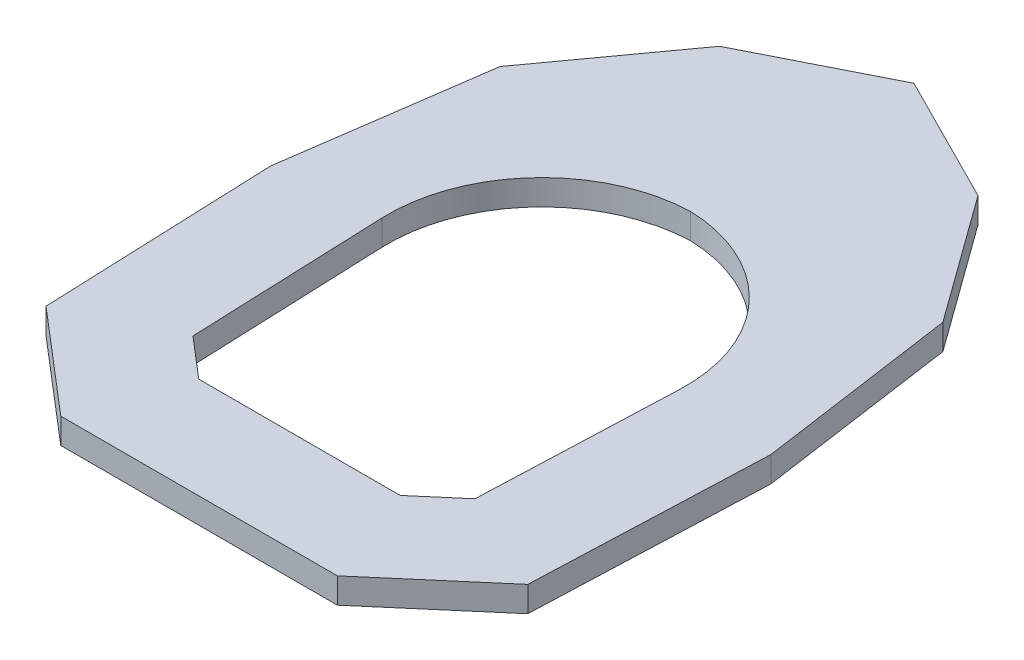
from build123d import *

# Parameters (mm, degrees)
BOSS_EXTRUDE1_DEPTH = 50


with BuildPart() as part:
    # Sketch1 → Boss-Extrude1 (new body)
    with BuildSketch(Plane(origin=(0, 0, 0), x_dir=(1, 0, 0), z_dir=(0, 1, 0))):
        Polygon((-490.415824699, -64.194072769), (-472.477870031, -524.138824529), (-270.660991621, -696.876695154), (273.24324441, -696.876695154), (475.06012282, -524.138824529), (492.998077488, -64.194072769), (436.803486749, 330.511591748), (255.52688097, 580.827312496), (1.291126394, 709.058947943), (-252.944628181, 580.827312496), (-434.22123396, 330.511591748), align=None)
        with BuildLine():
            Line((198.047881985, -498.167821548), (-198.047881985, -498.167821548))
            Line((-198.047881985, -498.167821548), (-277.326571574, -430.312089493))
            Line((-277.326571574, -430.312089493), (-292.42397797, -43.20146483))
            ThreePointArc((-292.42397797, -43.20146483), (-211.574023689, 174.749059805), (0, 271.058866137))
            ThreePointArc((0, 271.058866137), (211.574023689, 174.749059805), (292.42397797, -43.20146483))
            Line((292.42397797, -43.20146483), (277.326571574, -430.312089493))
            Line((277.326571574, -430.312089493), (198.047881985, -498.167821548))
        make_face(mode=Mode.SUBTRACT)
    extrude(amount=-BOSS_EXTRUDE1_DEPTH)


solid = part.part
